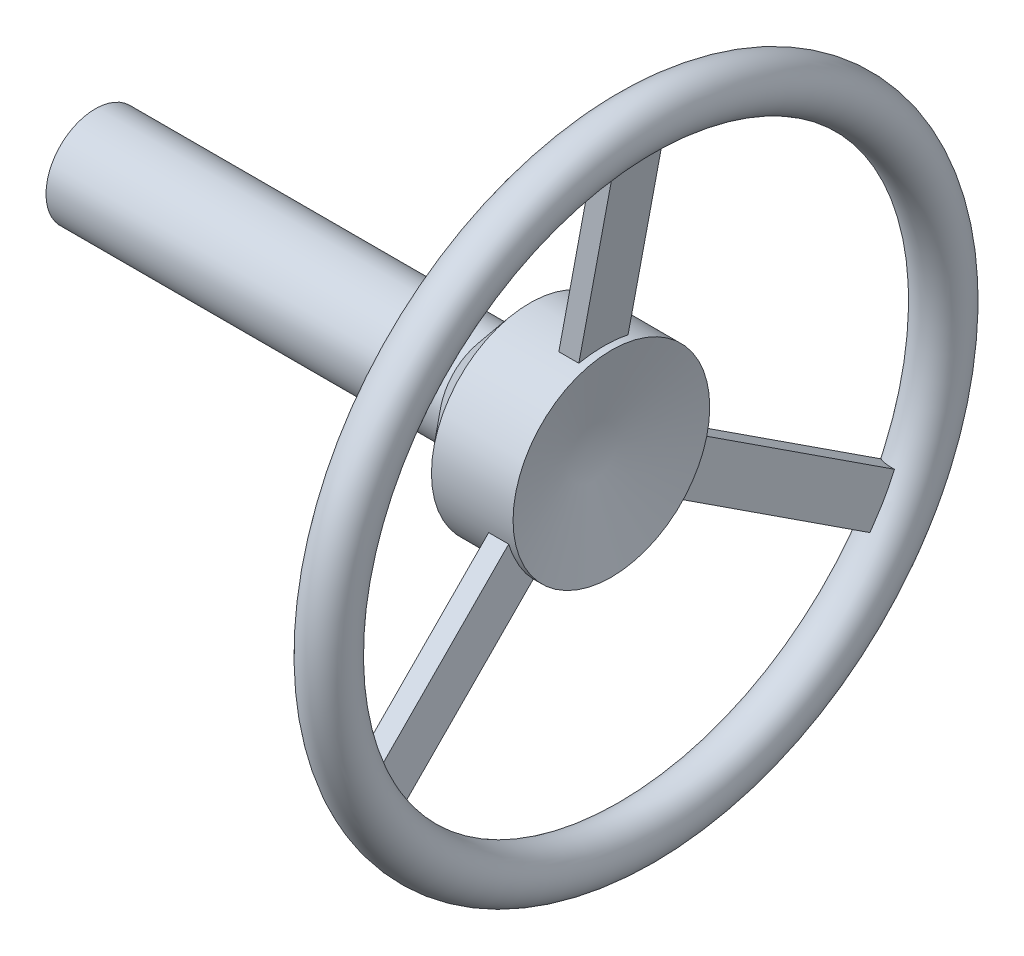
from build123d import *

# Parameters (mm, degrees)
SKETCH2_R           = 2.5
BOSS_EXTRUDE1_DEPTH = 2.5
CIRPATTERN1_COUNT   = 3


with BuildPart() as part:
    # Sketch1 → Revolve1 (revolve)
    with BuildSketch(Plane.XY, mode=Mode.PRIVATE) as revolve1_sk:
        Polygon((0.020355571, 0), (0.020355571, 5), (40.020355571, 5), (44.215853727, 10), (52.515853727, 10), (49.991035221, 0), align=None)
    revolve(revolve1_sk.sketch.rotate(Axis((49.991035221, 0, 0), (1, 0, 0)), 90), axis=Axis((49.991035221, 0, 0), (1, 0, 0)))



with BuildPart() as body_2:
    # Sketch2 → Revolve2 (revolve)
    with BuildSketch(Plane.XY, mode=Mode.PRIVATE) as revolve2_sk:
        with Locations((55.020355571, 31.25)):
            Circle(SKETCH2_R)
    revolve(revolve2_sk.sketch.rotate(Axis((-18.289344111, 0, 0), (1, 0, 0)), 270), axis=Axis((-18.289344111, 0, 0), (1, 0, 0)))


with BuildPart() as part_1:
    add(part.part)

    add(body_2.part)  # Boss-Extrude1 merges body 2
    # Sketch3 → Boss-Extrude1 (add, symmetric)
    with BuildSketch(Plane.XY):
        Polygon((49.581348424, 9.2), (51.615853727, 9.2), (56.035853727, 32.892680706), (54.001348424, 32.892680706), align=None)
    boss_extrude1 = extrude(amount=BOSS_EXTRUDE1_DEPTH, both=True)

    # CirPattern1: Boss-Extrude1 ×3 about axis
    cirpattern1_axis = Axis((0, 0, 0), (1, 0, 0))
    for i in range(1, CIRPATTERN1_COUNT):
        add(boss_extrude1.rotate(cirpattern1_axis, i * 360 / CIRPATTERN1_COUNT))


solid = part_1.part
